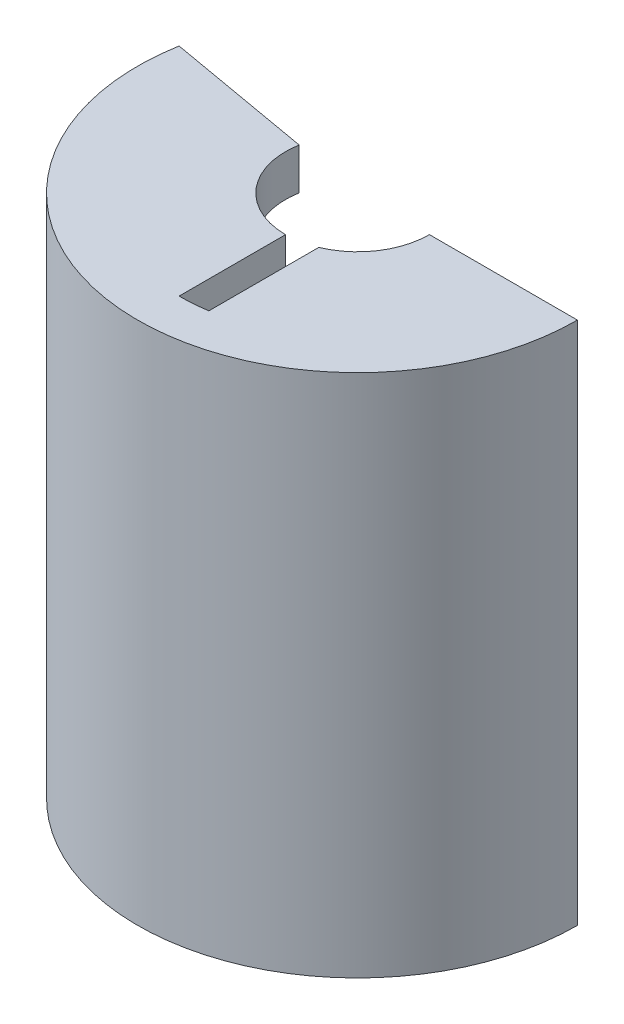
from build123d import *
from build123d.topology import SkipClean

# Parameters (mm, degrees)
REVOLVE1_ANGLE     = 190
CUT_EXTRUDE1_DEPTH = 45.06204684


with BuildPart() as part:
    # Sketch1 → Revolve1 (revolve)
    with BuildSketch(Plane.XY):
        Polygon((15.897098368, 102.642966667), (5.2, 102.642966667), (5.2, 99.642966667), (12.897098368, 99.642966667), (12.897098368, 77.4), (9.725, 77.4), (9.725, 67.748), (2.7, 67.748), (2.7, 64.748), (15.897098368, 64.748), align=None)
    revolve(axis=Axis((0, 104.537715, 0), (0, -1, 0)), revolution_arc=REVOLVE1_ANGLE)

    # Sketch2 → Cut-Extrude1 (cut, through all)
    with SkipClean():  # the faces are left unmerged after this step: merging them gives an invalid solid
        with BuildSketch(Plane(origin=(0, 102.642966667, 0), x_dir=(1, 0, 0), z_dir=(0, 1, 0))):
            with BuildLine():
                Line((0, 0), (0, -12.897098368))
                ThreePointArc((0, -12.897098368), (1.002621368, -12.858067378), (1.999174193, -12.741210651))
                Line((1.999174193, -12.741210651), (1.999174193, 0))
                Line((1.999174193, 0), (0, 0))
            make_face()
        extrude(amount=-CUT_EXTRUDE1_DEPTH, mode=Mode.SUBTRACT)


solid = part.part
